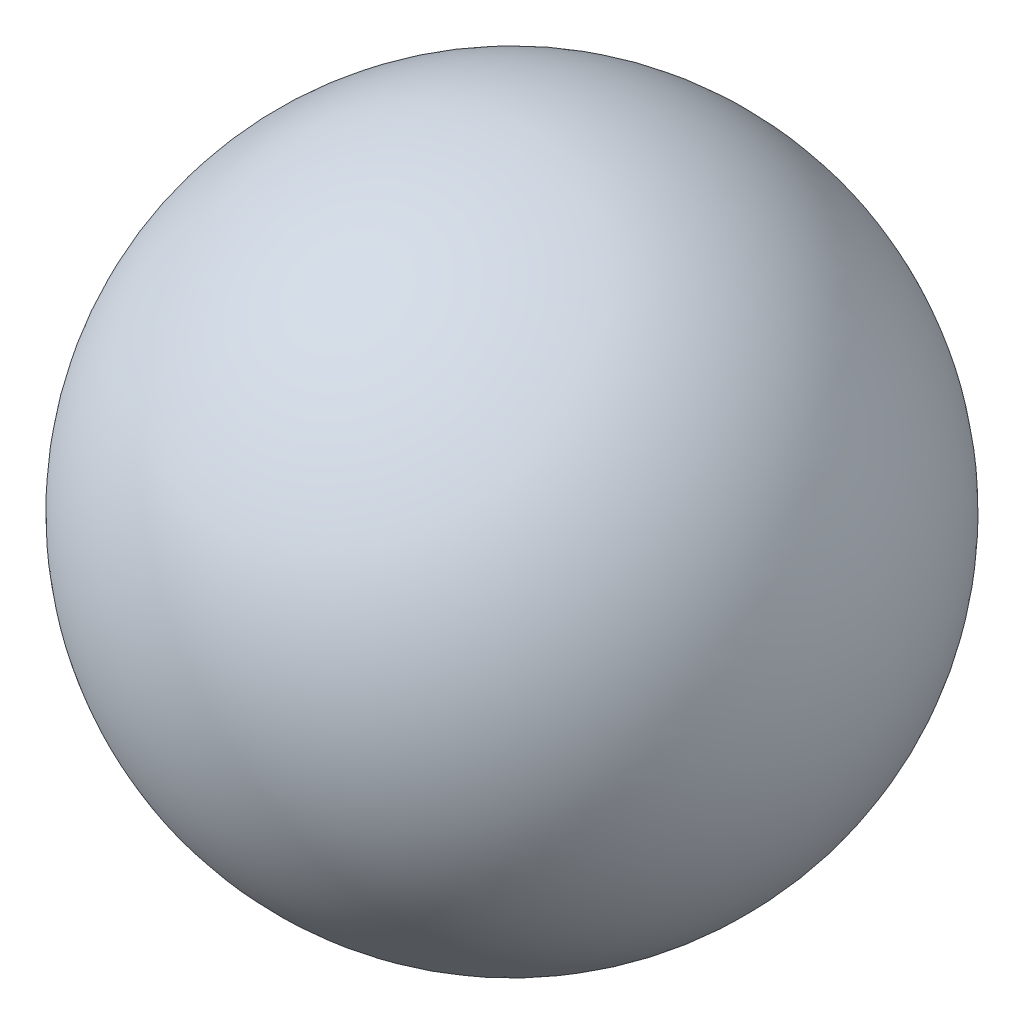
from build123d import *


with BuildPart() as part:
    # Bearing Ball Profile → Bearing Ball (revolve)
    with BuildSketch(Plane(origin=(0, 0, 0), x_dir=(0, 0, -1), z_dir=(1, 0, 0))):
        with BuildLine():
            Line((-1.157205295, 4.365625), (1.157205295, 4.365625))
            ThreePointArc((1.157205295, 4.365625), (0, 5.522830295), (-1.157205295, 4.365625))
        make_face()
    revolve(axis=Axis((0, 4.365625, 1.157205295), (0, 0, -1)))


solid = part.part
